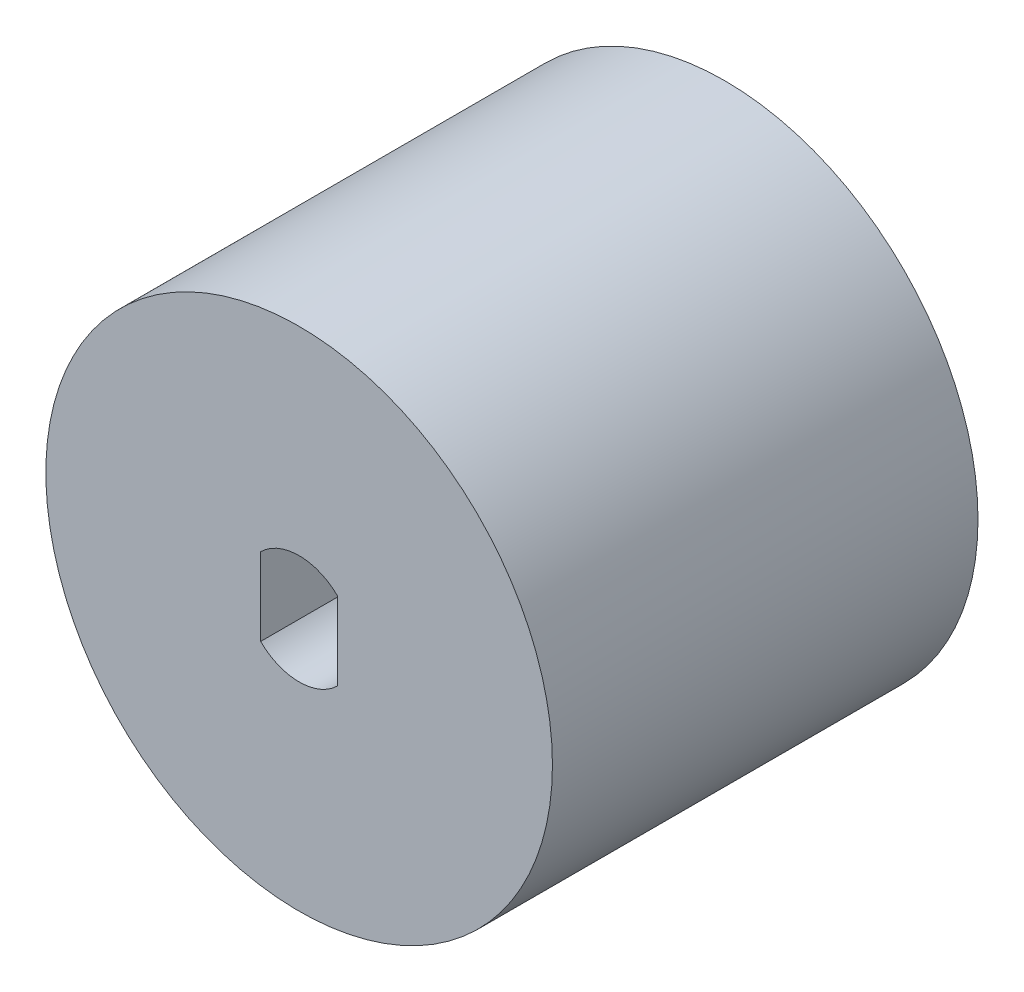
from build123d import *

# Parameters (mm, degrees)
SKETCH2_R           = 25
BOSS_EXTRUDE1_DEPTH = 4
SKETCH3_R           = 25
SKETCH3_R_2         = 1
BOSS_EXTRUDE2_DEPTH = 2
CUT_EXTRUDE1_DEPTH  = 36.860842154
CIRPATTERN1_COUNT   = 30
SKETCH6_R           = 25
SKETCH6_R_2         = 12.5
CUT_EXTRUDE2_DEPTH  = 36.860842154
SKETCH7_R           = 12.5
SKETCH7_R_2         = 7.5
BOSS_EXTRUDE3_DEPTH = 15


with BuildPart() as part:
    # Sketch2 → Boss-Extrude1 (new body)
    with BuildSketch(Plane.XY):
        Circle(SKETCH2_R)
        with BuildLine():
            Line((1.9, -1.918332609), (1.9, 1.918332609))
            ThreePointArc((1.9, 1.918332609), (0, 2.7), (-1.9, 1.918332609))
            Line((-1.9, 1.918332609), (-1.9, -1.918332609))
            ThreePointArc((-1.9, -1.918332609), (0, -2.7), (1.9, -1.918332609))
        make_face(mode=Mode.SUBTRACT)
    extrude(amount=-BOSS_EXTRUDE1_DEPTH)

    # Sketch3 → Boss-Extrude2 (add)
    with BuildSketch(Plane(origin=(0, 0, -4), x_dir=(-1, 0, 0), z_dir=(0, 0, -1))):
        with Locations(Location((0, 0, 0), (0, 0, 180))):
            Circle(SKETCH3_R)
        Circle(SKETCH3_R_2, mode=Mode.SUBTRACT)
    extrude(amount=BOSS_EXTRUDE2_DEPTH)

    # Sketch4 → Cut-Extrude1 (cut, symmetric)
    with BuildSketch(Plane.XY):
        with BuildLine():
            Line((-0.857142857, 18), (0.857142857, 18))
            Line((0.857142857, 18), (0.998868138, 20.976230892))
            ThreePointArc((0.998868138, 20.976230892), (0, 21), (-0.998868138, 20.976230892))
            Line((-0.998868138, 20.976230892), (-0.857142857, 18))
        make_face()
    cut_extrude1 = extrude(amount=CUT_EXTRUDE1_DEPTH, both=True, mode=Mode.SUBTRACT)

    # CirPattern1: Cut-Extrude1 ×30 about axis
    cirpattern1_axis = Axis((0, 0, 0), (0, 0, 1))
    for i in range(1, CIRPATTERN1_COUNT):
        add(cut_extrude1.rotate(cirpattern1_axis, i * 360 / CIRPATTERN1_COUNT), mode=Mode.SUBTRACT)

    # Sketch6 → Cut-Extrude2 (cut, through all)
    with BuildSketch(Plane.XY):
        Circle(SKETCH6_R)
        Circle(SKETCH6_R_2, mode=Mode.SUBTRACT)
    extrude(amount=-CUT_EXTRUDE2_DEPTH, mode=Mode.SUBTRACT)

    # Sketch7 → Boss-Extrude3 (add)
    with BuildSketch(Plane(origin=(0, 0, -6), x_dir=(-1, 0, 0), z_dir=(0, 0, -1))):
        with Locations(Location((0, 0, 0), (0, 0, 180))):
            Circle(SKETCH7_R)
        Circle(SKETCH7_R_2, mode=Mode.SUBTRACT)
    extrude(amount=BOSS_EXTRUDE3_DEPTH)


solid = part.part
